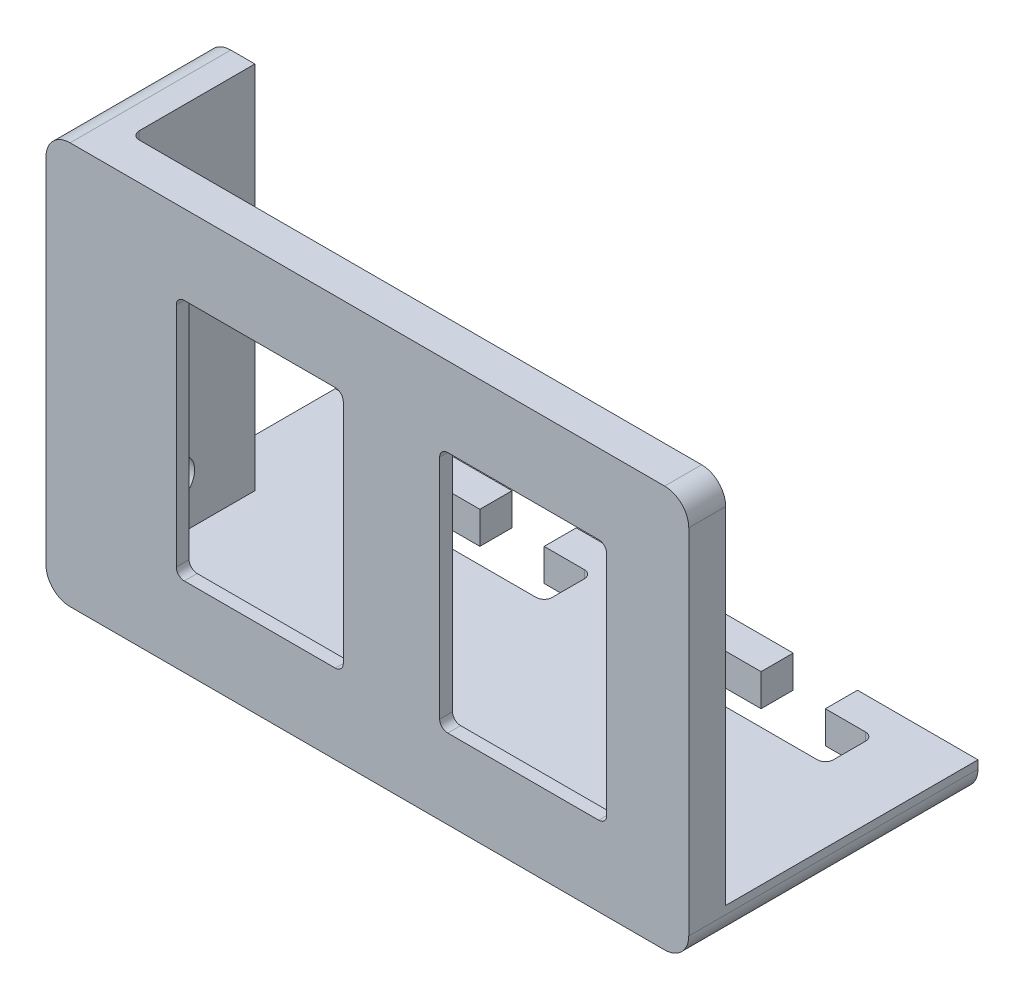
from build123d import *

# Parameters (mm, degrees)
BOSS_EXTRUDE1_DEPTH  = 15.875
SKETCH2_R            = 1.5875
MOUNTING_HOLES_DEPTH = 52.199274653
SKETCH3_W            = 13.2
SKETCH3_H            = 19.2
CUT_EXTRUDE2_DEPTH   = 55.113625512
SKETCH4_W            = 18.28
SKETCH4_H            = 24.28
SKETCH4_W_2          = 13.2
SKETCH4_H_2          = 19.2
CUT_EXTRUDE3_DEPTH   = 1.905
FILLET2_R            = 0.635
FILLET3_R            = 0.635
BOSS_EXTRUDE3_DEPTH  = 2.54
FILLET4_R            = 0.635
FILLET5_R            = 1.905


with BuildPart() as part:
    # Sketch1 → Boss-Extrude1 (new, symmetric)
    with BuildSketch(Plane(origin=(0, 0, 0), x_dir=(1, 0, 0), z_dir=(0, 1, 0))):
        Polygon((0, 0), (0, 12.7), (3.81, 12.7), (3.81, 2.921), (50.8, 2.921), (50.8, 0), align=None)
    extrude(amount=BOSS_EXTRUDE1_DEPTH, both=True)

    # Sketch2 → Mounting_Holes (cut, through all)
    with BuildSketch(Plane(origin=(3.81, 0, 0), x_dir=(0, 0, -1), z_dir=(1, 0, 0))):
        with Locations((6.35, 9.525)):
            Circle(SKETCH2_R)
        with Locations((6.35, -9.525)):
            Circle(SKETCH2_R)
    extrude(amount=-MOUNTING_HOLES_DEPTH, mode=Mode.SUBTRACT)

    # Sketch3 → Cut-Extrude2 (cut, through all)
    with BuildSketch(Plane(origin=(0, 0, -2.921), x_dir=(-1, 0, 0), z_dir=(0, 0, -1))):
        with Locations((-37.715, 0)):
            Rectangle(SKETCH3_W, SKETCH3_H)
        with Locations((-16.895, 0)):
            Rectangle(SKETCH3_W, SKETCH3_H)
    extrude(amount=-CUT_EXTRUDE2_DEPTH, mode=Mode.SUBTRACT)

    # Sketch4 → Cut-Extrude3 (cut)
    # profile 1 of 2: a face of its own
    with BuildSketch(Plane(origin=(0, 0, -2.921), x_dir=(-1, 0, 0), z_dir=(0, 0, -1))):
        with Locations((-37.715, 0)):
            Rectangle(SKETCH4_W, SKETCH4_H)
        with Locations((-37.715, 0)):
            Rectangle(SKETCH4_W_2, SKETCH4_H_2, mode=Mode.SUBTRACT)
    # profile 2 of 2: a face of its own
    with BuildSketch(Plane(origin=(0, 0, -2.921), x_dir=(-1, 0, 0), z_dir=(0, 0, -1))):
        with Locations((-16.895, 0)):
            Rectangle(SKETCH4_W, SKETCH4_H)
        with Locations((-16.895, 0)):
            Rectangle(SKETCH4_W_2, SKETCH4_H_2, mode=Mode.SUBTRACT)
    extrude(amount=-CUT_EXTRUDE3_DEPTH, mode=Mode.SUBTRACT)

    # Fillet2
    fillet2_edges = [part.edges().sort_by_distance(p)[0] for p in [
        (3.81, 0, -2.921),
        (23.495, -9.6, -0.508),
        (23.495, 9.6, -0.508),
        (10.295, 9.6, -0.508),
        (10.295, -9.6, -0.508),
        (44.315, 9.6, -0.508),
        (31.115, 9.6, -0.508),
        (31.115, -9.6, -0.508),
        (44.315, -9.6, -0.508),
    ]]
    fillet(fillet2_edges, radius=FILLET2_R)

    # Fillet3
    fillet3_edges = [part.edges().sort_by_distance(p)[0] for p in [
        (28.575, 0, -1.016),
        (28.575, 12.14, -1.9685),
        (37.715, -12.14, -1.016),
        (46.855, 0, -1.016),
        (46.855, -12.14, -1.9685),
        (37.715, 12.14, -1.016),
        (46.855, 12.14, -1.9685),
        (7.755, 0, -1.016),
        (7.755, 12.14, -1.9685),
        (16.895, -12.14, -1.016),
        (7.755, -12.14, -1.9685),
        (26.035, 0, -1.016),
        (26.035, -12.14, -1.9685),
        (16.895, 12.14, -1.016),
        (26.035, 12.14, -1.9685),
    ]]
    fillet(fillet3_edges, radius=FILLET3_R)

    # Sketch5 → Boss-Extrude3 (add)
    with BuildSketch(Plane.XZ.offset(15.875)):
        Polygon((50.8, 0), (50.8, -22.86), (41.275, -22.86), (41.275, -20.32), (45.085, -20.32), (45.085, -16.51), (32.385, -16.51), (32.385, -20.32), (36.195, -20.32), (36.195, -22.86), (19.05, -22.86), (19.05, -20.32), (22.86, -20.32), (22.86, -16.51), (10.16, -16.51), (10.16, -20.32), (13.97, -20.32), (13.97, -22.86), (0, -22.86), (0, 0), align=None)
    extrude(amount=-BOSS_EXTRUDE3_DEPTH)

    # Fillet4
    fillet4_edges = [part.edges().sort_by_distance(p)[0] for p in [
        (45.085, -14.605, -20.32),
        (45.085, -14.605, -16.51),
        (32.385, -14.605, -16.51),
        (32.385, -14.605, -20.32),
        (22.86, -14.605, -20.32),
        (22.86, -14.605, -16.51),
        (10.16, -14.605, -16.51),
        (10.16, -14.605, -20.32),
    ]]
    fillet(fillet4_edges, radius=FILLET4_R)

    # Fillet5
    fillet5_edges = [part.edges().sort_by_distance(p)[0] for p in [
        (0, 15.875, -6.35),
        (0, -15.875, -11.43),
        (50.8, -15.875, -11.43),
        (50.8, 15.875, -1.4605),
    ]]
    fillet(fillet5_edges, radius=FILLET5_R)


solid = part.part
